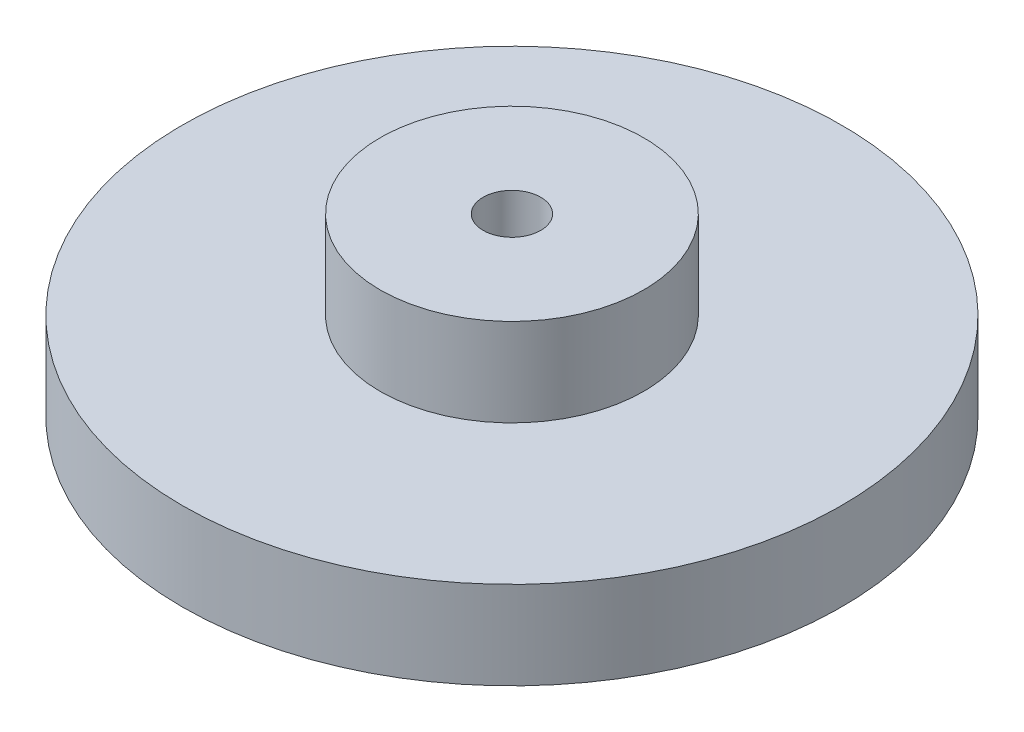
from build123d import *

# Parameters (mm, degrees)
SKETCH1_R           = 7.5
BOSS_EXTRUDE1_DEPTH = 2
SKETCH2_R           = 3
BOSS_EXTRUDE2_DEPTH = 2
SKETCH3_R           = 0.655
CUT_EXTRUDE1_DEPTH  = 2.89
SKETCH4_R           = 0.655
CUT_EXTRUDE3_DEPTH  = 1.11
CUT_EXTRUDE3_DRAFT  = 60


with BuildPart() as part:
    # Sketch1 → Boss-Extrude1 (new body)
    with BuildSketch(Plane(origin=(0, 0, 0), x_dir=(1, 0, 0), z_dir=(0, 1, 0))):
        with Locations(Location((0, 0, 0), (0, 0, 270))):
            Circle(SKETCH1_R)
    extrude(amount=BOSS_EXTRUDE1_DEPTH)

    # Sketch2 → Boss-Extrude2 (add)
    with BuildSketch(Plane(origin=(0, 2, 0), x_dir=(1, 0, 0), z_dir=(0, 1, 0))):
        with Locations(Location((0, 0, 0), (0, 0, 270))):
            Circle(SKETCH2_R)
    extrude(amount=BOSS_EXTRUDE2_DEPTH)

    # Sketch3 → Cut-Extrude1 (cut)
    with BuildSketch(Plane(origin=(0, 4, 0), x_dir=(1, 0, 0), z_dir=(0, 1, 0))):
        with Locations(Location((0, 0, 0), (0, 0, 270))):
            Circle(SKETCH3_R)
    extrude(amount=-CUT_EXTRUDE1_DEPTH, mode=Mode.SUBTRACT)


with BuildPart() as cut_extrude3_tool:
    # Sketch4 → Cut-Extrude3 (with draft: the straight prism first)
    with BuildSketch(Plane(origin=(0, 1.11, 0), x_dir=(1, 0, 0), z_dir=(0, 1, 0))):
        with Locations(Location((0, 0, 0), (0, 0, 270))):
            Circle(SKETCH4_R)
    extrude(amount=-CUT_EXTRUDE3_DEPTH)
    # Cut-Extrude3: the draft: its side faces are tilted about the plane it starts from
    cut_extrude3_sides = [cut_extrude3_tool.faces().sort_by_distance(p)[0] for p in [
        (0, 0.555, -0.655),
    ]]
    draft(cut_extrude3_sides, Plane(origin=(0, 1.11, 0), x_dir=(1, 0, 0), z_dir=(0, 1, 0)), CUT_EXTRUDE3_DRAFT)


with BuildPart() as part_1:
    add(part.part)

    # Cut-Extrude3: cut by cut_extrude3_tool
    add(cut_extrude3_tool.part, mode=Mode.SUBTRACT)


solid = part_1.part
